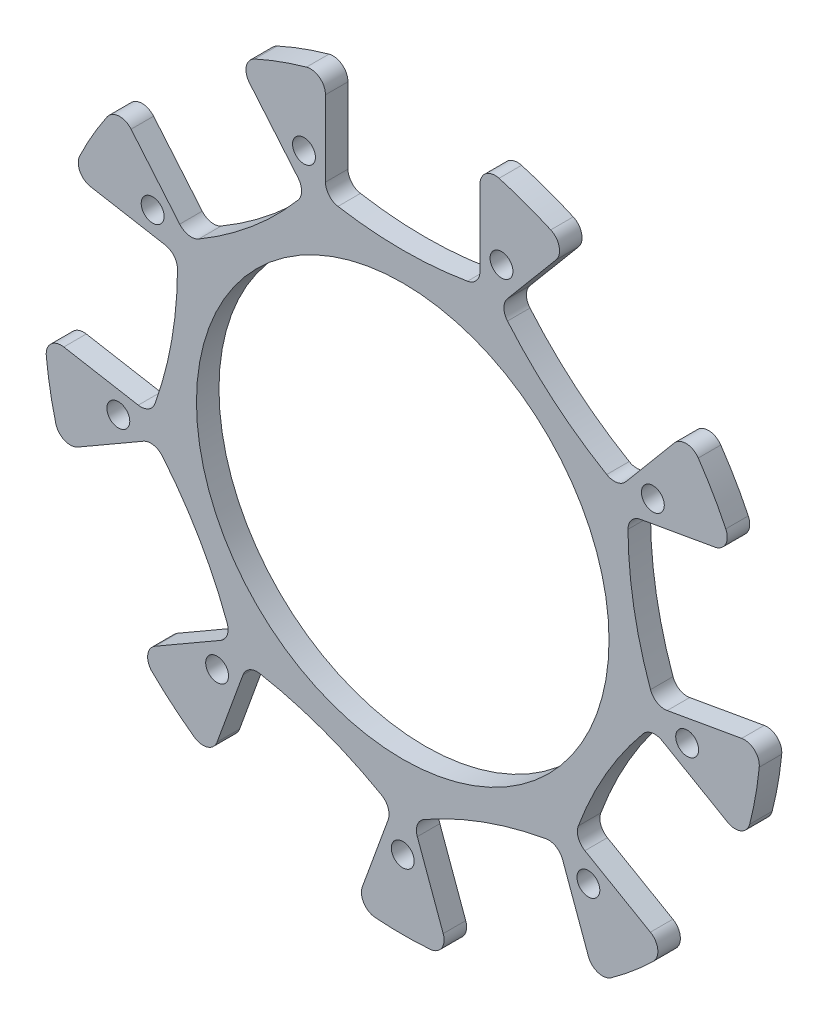
from build123d import *

# Parameters (mm, degrees)
SKETCH_1_R          = 47.75
EXTRUDE_1_DEPTH     = 3
CUT_EXTRUDE_1_DEPTH = 68.595303091
SKETCH_3_R          = 1.525
CUT_EXTRUDE_2_DEPTH = 68.564300519
SKETCH_4_R          = 27.5
CUT_EXTRUDE_3_DEPTH = 68.564300519
FILLET_1_R          = 2


with BuildPart() as part:
    # ｽｹｯﾁ1 → ﾎﾞｽ - 押し出し1 (new body)
    with BuildSketch(Plane.XY):
        Circle(SKETCH_1_R)
    extrude(amount=EXTRUDE_1_DEPTH)

    # ｽｹｯﾁ2 → ｶｯﾄ - 押し出し1 (cut, through all)
    with BuildSketch(Plane.XY.offset(3)):
        with BuildLine():
            Line((-10.3, 46.625878008), (-10.3, 32.325692416))
            ThreePointArc((-10.3, 32.325692416), (0, 31.28), (10.3, 32.325692416))
            Line((10.3, 32.325692416), (10.3, 46.625878008))
            ThreePointArc((10.3, 46.625878008), (0, 47.75), (-10.3, 46.625878008))
        make_face()
        with BuildLine():
            Line((22.08027891, 42.338207133), (12.888296795, 31.383629425))
            ThreePointArc((12.888296795, 31.383629425), (20.106396431, 23.961870181), (28.668812324, 18.142204665))
            Line((28.668812324, 18.142204665), (37.860794438, 29.096782374))
            ThreePointArc((37.860794438, 29.096782374), (30.693108363, 36.578622159), (22.08027891, 42.338207133))
        make_face()
        with BuildLine():
            Line((44.128949923, 18.240018604), (30.046016283, 15.756817436))
            ThreePointArc((30.046016283, 15.756817436), (30.804786514, 5.431714997), (33.623168743, -4.530222276))
            Line((33.623168743, -4.530222276), (47.706102383, -2.047021108))
            ThreePointArc((47.706102383, -2.047021108), (47.024570206, 8.291700484), (44.128949923, 18.240018604))
        make_face()
        with BuildLine():
            Line((45.529194829, -14.392877345), (33.144870827, -7.242784549))
            ThreePointArc((33.144870827, -7.242784549), (27.08927463, -15.64), (22.844870827, -25.082907867))
            Line((22.844870827, -25.082907867), (35.229194829, -32.233000663))
            ThreePointArc((35.229194829, -32.233000663), (41.352713031, -23.875), (45.529194829, -14.392877345))
        make_face()
        with BuildLine():
            Line((25.625823473, -40.291186025), (20.734871947, -26.853407149))
            ThreePointArc((20.734871947, -26.853407149), (10.698390083, -29.393585178), (1.377203959, -33.899022101))
            Line((1.377203959, -33.899022101), (6.268155485, -47.336800978))
            ThreePointArc((6.268155485, -47.336800978), (16.331461844, -44.870322643), (25.625823473, -40.291186025))
        make_face()
        with BuildLine():
            Line((-6.268155485, -47.336800978), (-1.377203959, -33.899022101))
            ThreePointArc((-1.377203959, -33.899022101), (-10.698390083, -29.393585178), (-20.734871947, -26.853407149))
            Line((-20.734871947, -26.853407149), (-25.625823473, -40.291186025))
            ThreePointArc((-25.625823473, -40.291186025), (-16.331461844, -44.870322643), (-6.268155485, -47.336800978))
        make_face()
        with BuildLine():
            Line((-35.229194829, -32.233000663), (-22.844870827, -25.082907867))
            ThreePointArc((-22.844870827, -25.082907867), (-27.08927463, -15.64), (-33.144870827, -7.242784549))
            Line((-33.144870827, -7.242784549), (-45.529194829, -14.392877345))
            ThreePointArc((-45.529194829, -14.392877345), (-41.352713031, -23.875), (-35.229194829, -32.233000663))
        make_face()
        with BuildLine():
            Line((-47.706102383, -2.047021108), (-33.623168743, -4.530222276))
            ThreePointArc((-33.623168743, -4.530222276), (-30.804786514, 5.431714997), (-30.046016283, 15.756817436))
            Line((-30.046016283, 15.756817436), (-44.128949923, 18.240018604))
            ThreePointArc((-44.128949923, 18.240018604), (-47.024570206, 8.291700484), (-47.706102383, -2.047021108))
        make_face()
        with BuildLine():
            Line((-37.860794438, 29.096782374), (-28.668812324, 18.142204665))
            ThreePointArc((-28.668812324, 18.142204665), (-20.106396431, 23.961870181), (-12.888296795, 31.383629425))
            Line((-12.888296795, 31.383629425), (-22.08027891, 42.338207133))
            ThreePointArc((-22.08027891, 42.338207133), (-30.693108363, 36.578622159), (-37.860794438, 29.096782374))
        make_face()
    extrude(amount=-CUT_EXTRUDE_1_DEPTH, mode=Mode.SUBTRACT)

    # ｽｹｯﾁ3 → ｶｯﾄ - 押し出し2 (cut, through all)
    with BuildSketch(Plane.XY.offset(3)):
        with Locations((0, -38.5)):
            Circle(SKETCH_3_R)
        with Locations((-24.747322973, -29.49271106)):
            Circle(SKETCH_3_R)
        with Locations((-37.915098491, -6.68545484)):
            Circle(SKETCH_3_R)
        with Locations((-33.341978046, 19.25)):
            Circle(SKETCH_3_R)
        with Locations((-13.167775518, 36.1781659)):
            Circle(SKETCH_3_R)
        with Locations((13.167775518, 36.1781659)):
            Circle(SKETCH_3_R)
        with Locations((33.341978046, 19.25)):
            Circle(SKETCH_3_R)
        with Locations((37.915098491, -6.68545484)):
            Circle(SKETCH_3_R)
        with Locations((24.747322973, -29.49271106)):
            Circle(SKETCH_3_R)
    extrude(amount=-CUT_EXTRUDE_2_DEPTH, mode=Mode.SUBTRACT)

    # ｽｹｯﾁ4 → ｶｯﾄ - 押し出し3 (cut, through all)
    with BuildSketch(Plane(origin=(0, 0, 0), x_dir=(-1, 0, 0), z_dir=(0, 0, -1))):
        Circle(SKETCH_4_R)
    extrude(amount=-CUT_EXTRUDE_3_DEPTH, mode=Mode.SUBTRACT)

    # ﾌｨﾚｯﾄ1
    fillet_1_edges = [part.edges().sort_by_distance(p)[0] for p in [
        (-30.046016283, 15.756817436, 1.5),
        (-33.623168743, -4.530222276, 1.5),
        (-47.706102383, -2.047021108, 1.5),
        (-44.128949923, 18.240018604, 1.5),
        (-12.888296795, 31.383629425, 1.5),
        (-28.668812324, 18.142204665, 1.5),
        (-37.860794438, 29.096782374, 1.5),
        (-22.08027891, 42.338207133, 1.5),
        (-20.734871947, -26.853407149, 1.5),
        (-1.377203959, -33.899022101, 1.5),
        (-6.268155485, -47.336800978, 1.5),
        (-25.625823473, -40.291186025, 1.5),
        (-33.144870827, -7.242784549, 1.5),
        (-22.844870827, -25.082907867, 1.5),
        (-35.229194829, -32.233000663, 1.5),
        (-45.529194829, -14.392877345, 1.5),
        (22.844870827, -25.082907867, 1.5),
        (33.144870827, -7.242784549, 1.5),
        (45.529194829, -14.392877345, 1.5),
        (35.229194829, -32.233000663, 1.5),
        (1.377203959, -33.899022101, 1.5),
        (20.734871947, -26.853407149, 1.5),
        (25.625823473, -40.291186025, 1.5),
        (6.268155485, -47.336800978, 1.5),
        (28.668812324, 18.142204665, 1.5),
        (12.888296795, 31.383629425, 1.5),
        (22.08027891, 42.338207133, 1.5),
        (37.860794438, 29.096782374, 1.5),
        (33.623168743, -4.530222276, 1.5),
        (30.046016283, 15.756817436, 1.5),
        (44.128949923, 18.240018604, 1.5),
        (47.706102383, -2.047021108, 1.5),
        (10.3, 32.325692416, 1.5),
        (-10.3, 32.325692416, 1.5),
        (-10.3, 46.625878008, 1.5),
        (10.3, 46.625878008, 1.5),
    ]]
    fillet(fillet_1_edges, radius=FILLET_1_R)


solid = part.part
